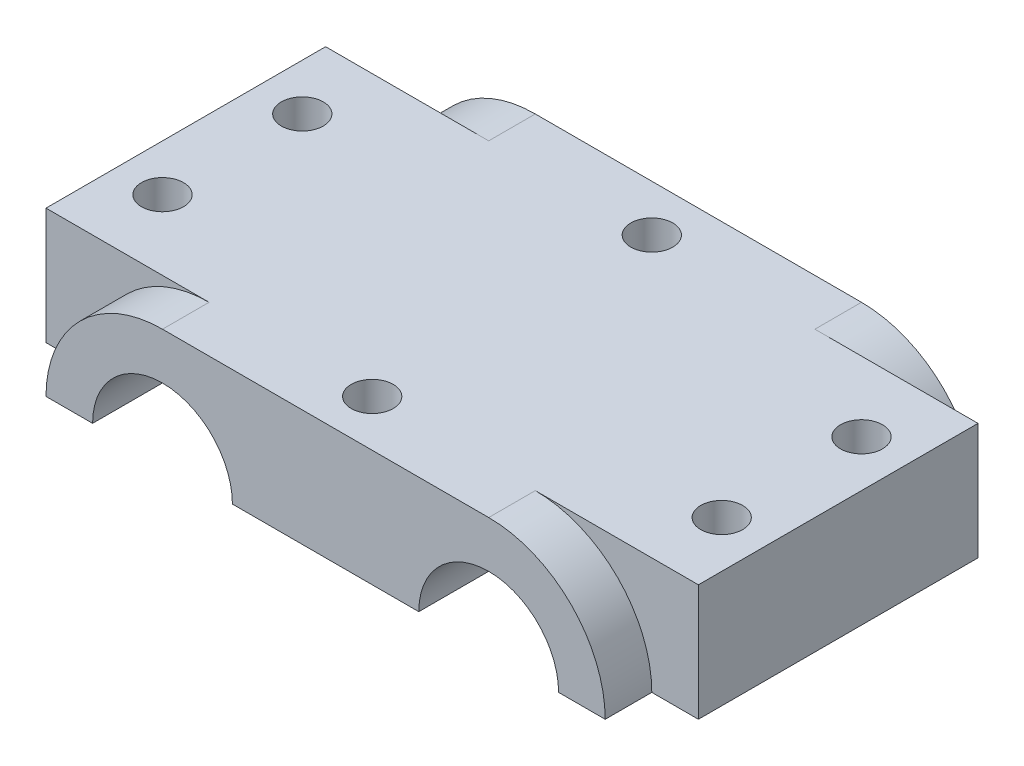
from build123d import *

# Parameters (mm, degrees)
BOSS_EXTRUDE1_DEPTH   = 20
BOSS_EXTRUDE2_DEPTH   = 15
F_3_0MM_DOWEL_HOLE1_D = 4.5


with BuildPart() as part:
    # Sketch1 → Boss-Extrude1 (new, symmetric)
    with BuildSketch(Plane.XY):
        with BuildLine():
            Line((-10, 0), (10, 0))
            ThreePointArc((10, 0), (17.5, 7.5), (25, 0))
            Line((25, 0), (30, 0))
            ThreePointArc((30, 0), (26.338834765, 8.838834765), (17.5, 12.5))
            Line((17.5, 12.5), (-17.5, 12.5))
            ThreePointArc((-17.5, 12.5), (-26.338834765, 8.838834765), (-30, 0))
            Line((-30, 0), (-25, 0))
            ThreePointArc((-25, 0), (-17.5, 7.5), (-10, 0))
        make_face()
    extrude(amount=BOSS_EXTRUDE1_DEPTH, both=True)

    # Sketch2 → Boss-Extrude2 (add, symmetric)
    with BuildSketch(Plane.XY):
        with BuildLine():
            ThreePointArc((-17.5, 12.5), (-26.338834765, 8.838834765), (-30, 0))
            Line((-30, 0), (-35, 0))
            Line((-35, 0), (-35, 12.5))
            Line((-35, 12.5), (-17.5, 12.5))
        make_face()
        with BuildLine():
            ThreePointArc((30, 0), (26.338834765, 8.838834765), (17.5, 12.5))
            Line((17.5, 12.5), (35, 12.5))
            Line((35, 12.5), (35, 0))
            Line((35, 0), (30, 0))
        make_face()
    extrude(amount=BOSS_EXTRUDE2_DEPTH, both=True)

    # Ø3.0mm Dowel Hole1 (through all)
    with Locations(Plane(origin=(0, 12.5, 0), x_dir=(1, 0, 0), z_dir=(0, 1, 0))):
        with Locations((0, 15), (0, -15), (30, 7.5), (30, -7.5), (-30, -7.5), (-30, 7.5)):
            Hole(F_3_0MM_DOWEL_HOLE1_D / 2)


solid = part.part
